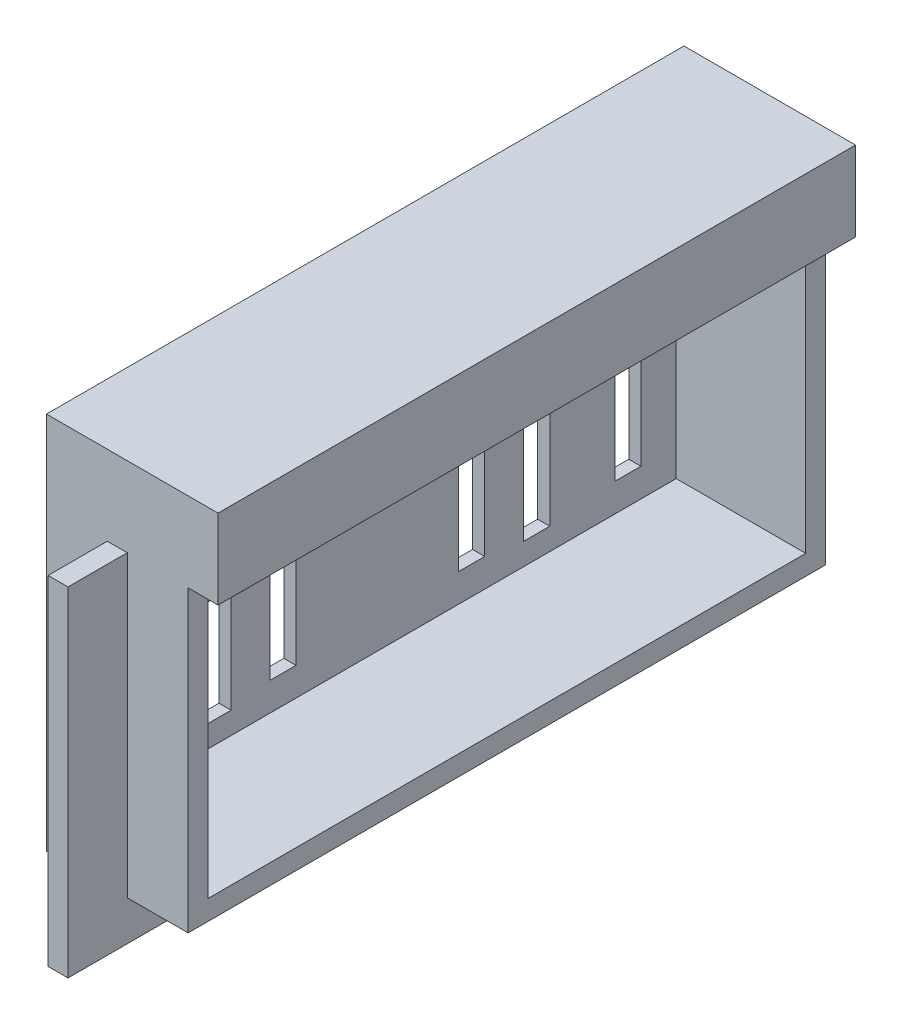
from build123d import *

# Parameters (mm, degrees)
EXTRUDE_1_DEPTH     = 38
SKETCH_2_W          = 60
SKETCH_2_H          = 34
CUT_EXTRUDE_1_DEPTH = 13
SKETCH_3_R          = 5
SKETCH_3_W          = 2.616489735
SKETCH_3_H          = 10.586779654
SKETCH_3_W_2        = 2.616489734
CUT_EXTRUDE_4_DEPTH = 31
SKETCH_4_W          = 2
SKETCH_4_H          = 75.8952895
EXTRUDE_3_DEPTH     = 4
SKETCH_5_W          = 5.94764475
SKETCH_5_H          = 8
CUT_EXTRUDE_5_DEPTH = 4
SKETCH_6_W          = 64
SKETCH_6_H          = 8
EXTRUDE_4_DEPTH     = 3


with BuildPart() as part:
    # 草图1 → 凸台-拉伸1 (new body)
    with BuildSketch(Plane(origin=(0, 0, 0), x_dir=(1, 0, 0), z_dir=(0, 1, 0))):
        Polygon((-2, 75.8952895), (0, 75.8952895), (0, 69.94764475), (6.11103449, 69.94764475), (6.11103449, 5.94764475), (0, 5.94764475), (0, 0), (-2, 0), (-2, 5.94764475), (-8.11103449, 5.94764475), (-8.11103449, 69.94764475), (-2, 69.94764475), align=None)
    extrude(amount=EXTRUDE_1_DEPTH)

    # 草图2 → 切除-拉伸1 (cut)
    with BuildSketch(Plane(origin=(6.11103449, 0, 0), x_dir=(0, 0, -1), z_dir=(1, 0, 0))):
        with Locations((37.94764475, 19)):
            Rectangle(SKETCH_2_W, SKETCH_2_H)
    extrude(amount=-CUT_EXTRUDE_1_DEPTH, mode=Mode.SUBTRACT)

    # 草图3 → 切除-拉伸4 (cut)
    with BuildSketch(Plane.ZY.offset(8.11103449)):
        with Locations((-53.94764475, 28.5)):
            Circle(SKETCH_3_R)
        with Locations((-63.098105483, 10.137074157)):
            Rectangle(SKETCH_3_W, SKETCH_3_H)
        with Locations((-47.413673753, 10.137074157)):
            Rectangle(SKETCH_3_W, SKETCH_3_H)
        with BuildLine():
            ThreePointArc((-46.105428885, 28.079391153), (-29.781734116, 28.710374202), (-46.116264816, 28.5))
            Line((-46.116264816, 28.5), (-46.105428885, 28.5))
            Line((-46.105428885, 28.5), (-46.105428885, 28.079391153))
        make_face()
        with Locations((-28.470779817, 10.143507991)):
            Rectangle(SKETCH_3_W, SKETCH_3_H)
        with Locations((-53.94764475, 9.5)):
            Rectangle(SKETCH_3_W_2, SKETCH_3_H)
        with Locations((-21.94764475, 28.5)):
            Circle(SKETCH_3_R)
        with Locations((-12.808019949, 10.143507991)):
            Rectangle(SKETCH_3_W_2, SKETCH_3_H)
        with Locations((-21.94764475, 9.5)):
            Rectangle(SKETCH_3_W_2, SKETCH_3_H)
    extrude(amount=-CUT_EXTRUDE_4_DEPTH, mode=Mode.SUBTRACT)

    # 草图4 → 凸台-拉伸3 (add)
    with BuildSketch(Plane.XZ):
        with Locations((-1, -37.94764475)):
            Rectangle(SKETCH_4_W, SKETCH_4_H)
    extrude(amount=EXTRUDE_3_DEPTH)

    # 草图5 → 切除-拉伸5 (cut)
    with BuildSketch(Plane.ZY.offset(2)):
        with Locations((-72.921467125, 34)):
            Rectangle(SKETCH_5_W, SKETCH_5_H)
        with Locations((-2.973822375, 34)):
            Rectangle(SKETCH_5_W, SKETCH_5_H)
    extrude(amount=-CUT_EXTRUDE_5_DEPTH, mode=Mode.SUBTRACT)

    # 草图6 → 凸台-拉伸4 (add)
    with BuildSketch(Plane(origin=(6.11103449, 0, 0), x_dir=(0, 0, -1), z_dir=(1, 0, 0))):
        with Locations((37.94764475, 34)):
            Rectangle(SKETCH_6_W, SKETCH_6_H)
    extrude(amount=EXTRUDE_4_DEPTH)


solid = part.part
